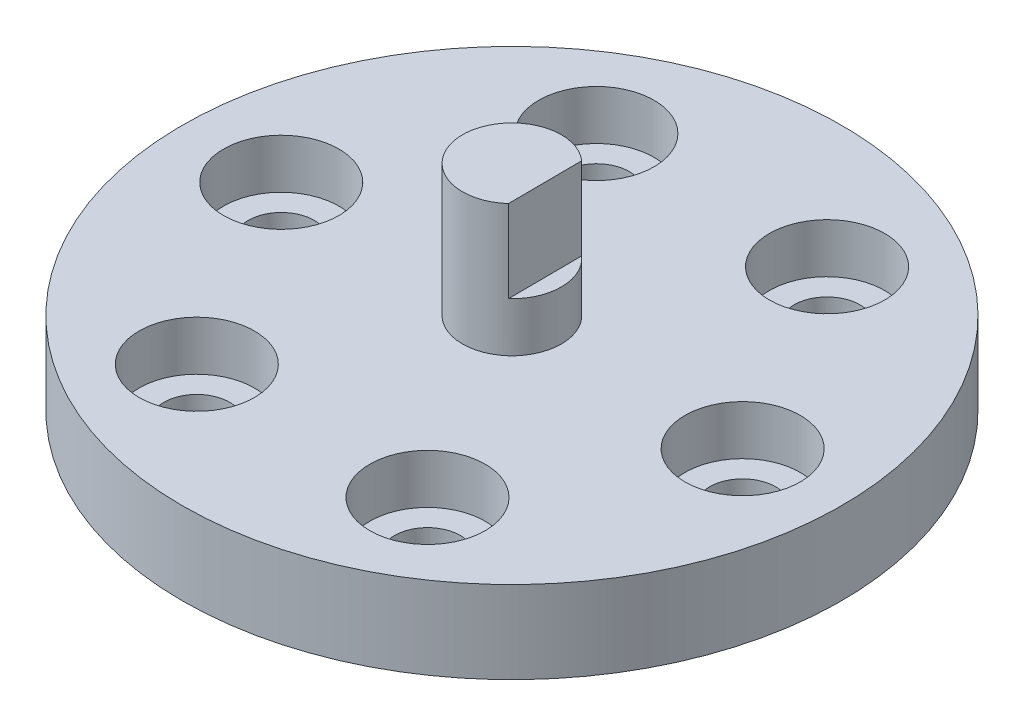
from build123d import *

# Parameters (mm, degrees)
SKETCH_1_R          = 20
EXTRUDE_1_DEPTH     = 5
SKETCH_2_R          = 2
CUT_EXTRUDE_1_DEPTH = 29.722813233
SKETCH_3_R          = 3.5
CUT_EXTRUDE_2_DEPTH = 3
SKETCH_4_R          = 3
EXTRUDE_2_DEPTH     = 8
CUT_EXTRUDE_START   = -5
CUT_EXTRUDE_3_DEPTH = 5


with BuildPart() as part:
    # 草图1 → 凸台-拉伸1 (new body)
    with BuildSketch(Plane(origin=(0, 0, 0), x_dir=(1, 0, 0), z_dir=(0, 1, 0))):
        with Locations(Location((0, 0, 0), (0, 0, 270))):
            Circle(SKETCH_1_R)
    extrude(amount=EXTRUDE_1_DEPTH)

    # 草图2 → 切除-拉伸1 (cut, through all)
    with BuildSketch(Plane(origin=(0, 5, 0), x_dir=(1, 0, 0), z_dir=(0, 1, 0))):
        with Locations(Location((14, 0, 0), (0, 0, 270))):
            Circle(SKETCH_2_R)
        with Locations(Location((7, -12.124355653, 0), (0, 0, 270))):
            Circle(SKETCH_2_R)
        with Locations(Location((-7, -12.124355653, 0), (0, 0, 270))):
            Circle(SKETCH_2_R)
        with Locations(Location((-14, 0, 0), (0, 0, 270))):
            Circle(SKETCH_2_R)
        with Locations(Location((-7, 12.124355653, 0), (0, 0, 270))):
            Circle(SKETCH_2_R)
        with Locations(Location((7, 12.124355653, 0), (0, 0, 270))):
            Circle(SKETCH_2_R)
    extrude(amount=-CUT_EXTRUDE_1_DEPTH, mode=Mode.SUBTRACT)

    # 草图3 → 切除-拉伸2 (cut)
    with BuildSketch(Plane(origin=(0, 5, 0), x_dir=(1, 0, 0), z_dir=(0, 1, 0))):
        with Locations(Location((14, 0, 0), (0, 0, 270))):
            Circle(SKETCH_3_R)
        with Locations(Location((7, -12.124355653, 0), (0, 0, 270))):
            Circle(SKETCH_3_R)
        with Locations(Location((-7, -12.124355653, 0), (0, 0, 270))):
            Circle(SKETCH_3_R)
        with Locations(Location((-14, 0, 0), (0, 0, 270))):
            Circle(SKETCH_3_R)
        with Locations(Location((-7, 12.124355653, 0), (0, 0, 270))):
            Circle(SKETCH_3_R)
        with Locations(Location((7, 12.124355653, 0), (0, 0, 270))):
            Circle(SKETCH_3_R)
    extrude(amount=-CUT_EXTRUDE_2_DEPTH, mode=Mode.SUBTRACT)

    # 草图4 → 凸台-拉伸2 (add)
    with BuildSketch(Plane(origin=(0, 5, 0), x_dir=(1, 0, 0), z_dir=(0, 1, 0))):
        with Locations(Location((0, 0, 0), (0, 0, 270))):
            Circle(SKETCH_4_R)
    extrude(amount=EXTRUDE_2_DEPTH)

    # 草图5 → 切除-拉伸3 (cut)
    with BuildSketch(Plane(origin=(0, 13, 0), x_dir=(1, 0, 0), z_dir=(0, 1, 0)).offset(CUT_EXTRUDE_START)):
        with BuildLine():
            Line((2.014530219, -2.222986279), (1.985384834, 2.249054704))
            ThreePointArc((1.985384834, 2.249054704), (2.99993629, 0.019551319), (2.014530219, -2.222986279))
        make_face()
    extrude(amount=CUT_EXTRUDE_3_DEPTH, mode=Mode.SUBTRACT)


solid = part.part
